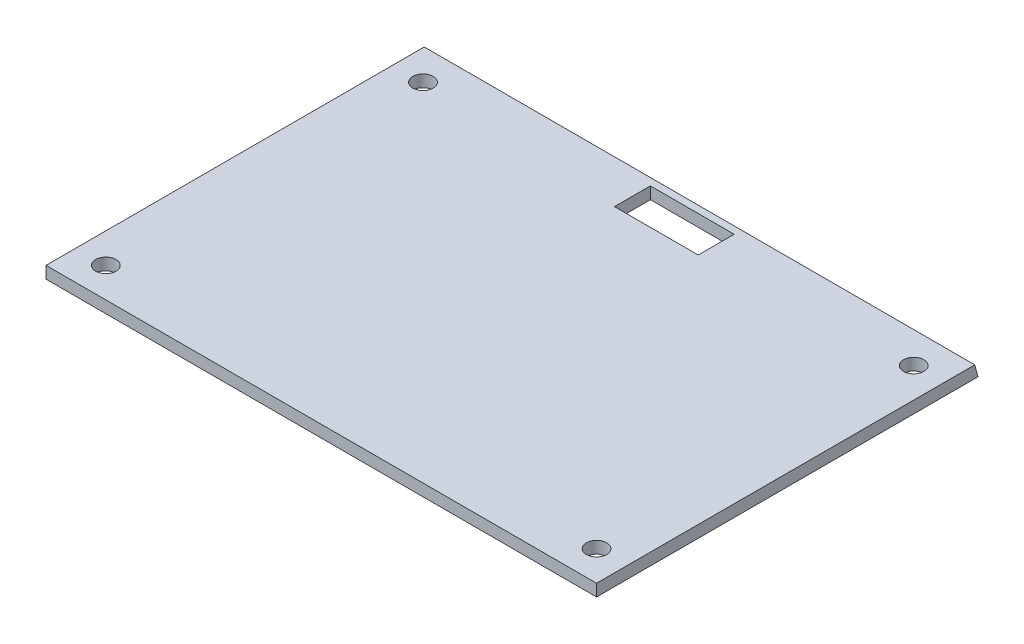
from build123d import *

# Parameters (mm, degrees)
SKETCH_1_W                               = 92
SKETCH_1_H                               = 2
REAR_COVER_2MM_1_DEPTH                   = 65
SKETCH_3_W                               = 14
SKETCH_3_H                               = 6
DISPLAY_WIRE_EXIT_14X6_3_DEPTH           = 4
REAR_COVER_CAGE_ROOF_CLEARANCE_207_DEPTH = 94
SKETCH_5_R                               = 1.7
REAR_COVER_M3_CLEARANCE_FINAL_208_DEPTH  = 4


with BuildPart() as part:
    # Эскиз1 → Rear_cover_2mm_1 (new body)
    with BuildSketch(Plane.XY.offset(55)):
        with Locations((0, -45)):
            Rectangle(SKETCH_1_W, SKETCH_1_H)
    extrude(amount=REAR_COVER_2MM_1_DEPTH)

    # Эскиз3 → Display_wire_exit_14x6_3 (cut)
    with BuildSketch(Plane(origin=(0, -47, 0), x_dir=(1, 0, 0), z_dir=(0, 1, 0))):
        with Locations((0, -61)):
            Rectangle(SKETCH_3_W, SKETCH_3_H)
    extrude(amount=DISPLAY_WIRE_EXIT_14X6_3_DEPTH, mode=Mode.SUBTRACT)

    # Эскиз4 → Rear_cover_cage_roof_clearance_207 (cut)
    with BuildSketch(Plane(origin=(-47, 0, 0), x_dir=(0, 0, -1), z_dir=(1, 0, 0))):
        Polygon((-10, -47), (-10, -40), (-57.861284772, -40), (-55.985640425, -47), align=None)
    extrude(amount=REAR_COVER_CAGE_ROOF_CLEARANCE_207_DEPTH, mode=Mode.SUBTRACT)

    # Эскиз5 → Rear_cover_M3_clearance_final_208 (cut)
    with BuildSketch(Plane(origin=(0, -47, 0), x_dir=(1, 0, 0), z_dir=(0, 1, 0))):
        with Locations(Location((-41, -62, 0), (0, 0, 90))):
            Circle(SKETCH_5_R)
        with Locations(Location((41, -62, 0), (0, 0, 90))):
            Circle(SKETCH_5_R)
        with Locations(Location((-41, -115, 0), (0, 0, 90))):
            Circle(SKETCH_5_R)
        with Locations(Location((41, -115, 0), (0, 0, 90))):
            Circle(SKETCH_5_R)
    extrude(amount=REAR_COVER_M3_CLEARANCE_FINAL_208_DEPTH, mode=Mode.SUBTRACT)


solid = part.part
